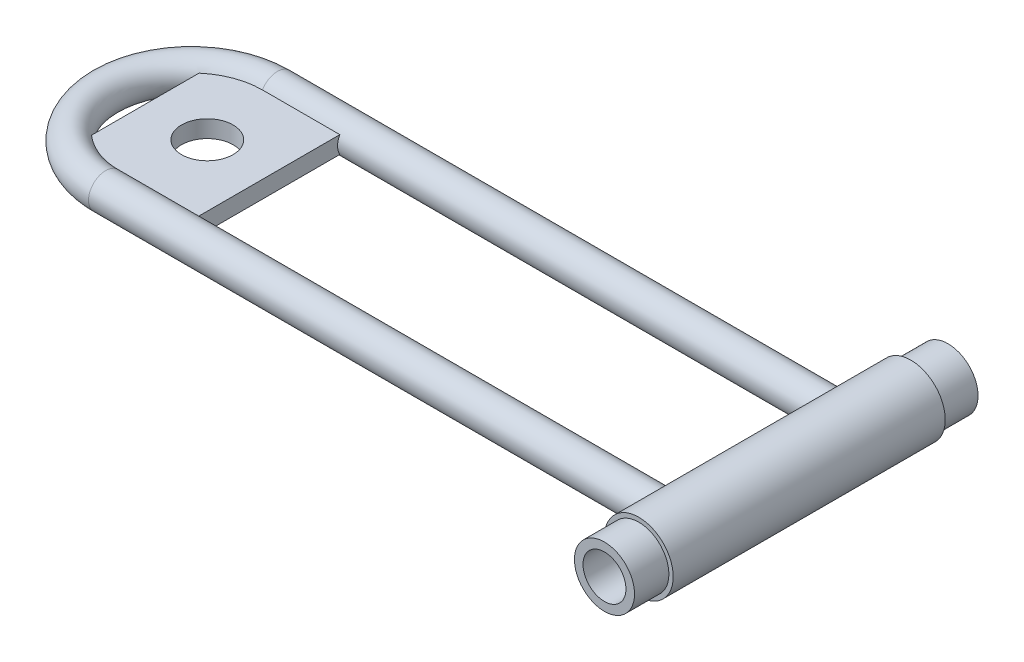
from build123d import *
from build123d.topology import SkipClean

# Parameters (mm, degrees)
SKETCH1_R           = 6.35
SKETCH1_R_2         = 3.175
BOSS_EXTRUDE1_DEPTH = 62.992
SKETCH3_R           = 3.175
SKETCH6_W           = 22.86
SKETCH6_H           = 1.5875
BOSS_EXTRUDE3_DEPTH = 29.21
SKETCH7_R           = 4.7625
CUT_EXTRUDE1_DEPTH  = 29.21
BOSS_EXTRUDE5_START = 6.35
SKETCH9_R           = 6.35
SKETCH9_R_2         = 3.175
BOSS_EXTRUDE5_DEPTH = 6.35
CUT_EXTRUDE6_START  = -12.7
SKETCH10_R          = 6.35
SKETCH10_R_2        = 5.55625
CUT_EXTRUDE6_DEPTH  = 12.7
SKETCH12_R          = 6.35
SKETCH12_R_2        = 5.55625
CUT_EXTRUDE7_DEPTH  = 12.7
CUT_EXTRUDE8_START  = -6.35
SKETCH13_R          = 5.55625
SKETCH13_R_2        = 3.175
CUT_EXTRUDE8_DEPTH  = 6.35
SKETCH14_R          = 5.55625
SKETCH14_R_2        = 3.175
CUT_EXTRUDE9_DEPTH  = 6.35
SKETCH16_R          = 3.96875
CUT_EXTRUDE11_DEPTH = 142.896915114
BOSS_EXTRUDE7_START = 0.508
SKETCH18_R          = 5.55625
SKETCH18_R_2        = 3.96875
BOSS_EXTRUDE7_DEPTH = 0.508


with BuildPart() as part:
    # Sketch1 → Boss-Extrude1 (new body)
    with BuildSketch(Plane.XY):
        Circle(SKETCH1_R)
        Circle(SKETCH1_R_2, mode=Mode.SUBTRACT)
    extrude(amount=BOSS_EXTRUDE1_DEPTH)

    # Sweep1: sweep along a path in Sketch4
    with BuildLine(Plane(origin=(0, 0, 0), x_dir=(1, 0, 0), z_dir=(0, 1, 0))) as sweep1_path:
        Line((-3.81, -15.663931971), (-107.95, -15.663931971))
        ThreePointArc((-107.95, -15.663931971), (-123.665226198, -31.37915817), (-107.95, -47.094384368))
        Line((-107.95, -47.094384368), (-3.81, -47.094384368))
    # Sketch3 → Sweep1 (sweep)
    with BuildSketch(Plane.ZY.offset(3.81)):
        with Locations((47.244, 0)):
            Circle(SKETCH3_R)
    sweep(path=sweep1_path.line)

    # Sketch6 → Boss-Extrude3 (add)
    with BuildSketch(Plane.XY.offset(15.24)):
        with Locations((-105.071320577, -0.79375)):
            Rectangle(SKETCH6_W, SKETCH6_H)
        with Locations((-105.071320577, 0.79375)):
            Rectangle(SKETCH6_W, SKETCH6_H)
    extrude(amount=BOSS_EXTRUDE3_DEPTH)

    # Sketch7 → Cut-Extrude1 (cut)
    with BuildSketch(Plane(origin=(0, 1.5875, 0), x_dir=(1, 0, 0), z_dir=(0, 1, 0))):
        with Locations(Location((-105.071320577, -31.341130791, 0), (0, 0, 180))):
            Circle(SKETCH7_R)
    extrude(amount=-CUT_EXTRUDE1_DEPTH, mode=Mode.SUBTRACT)

    # Sketch9 → Boss-Extrude5 (add)
    with BuildSketch(Plane(origin=(0, 0, 0), x_dir=(-1, 0, 0), z_dir=(0, 0, -1)).offset(BOSS_EXTRUDE5_START)):
        Circle(SKETCH9_R)
        Circle(SKETCH9_R_2, mode=Mode.SUBTRACT)
    boss_extrude5 = extrude(amount=-BOSS_EXTRUDE5_DEPTH)

    # Mirror1: Boss-Extrude5 across plane
    with SkipClean():  # the faces are left unmerged after this step: merging them gives an invalid solid
        add(boss_extrude5.mirror(Plane.XY.offset(31.496)))

    # Sketch10 → Cut-Extrude6 (cut)
    with BuildSketch(Plane.XY.offset(69.342).offset(CUT_EXTRUDE6_START)):
        with Locations(Location((0, 0, 0), (0, 0, 180))):
            Circle(SKETCH10_R)
        with Locations(Location((0, 0, 0), (0, 0, 180))):
            Circle(SKETCH10_R_2, mode=Mode.SUBTRACT)
    extrude(amount=CUT_EXTRUDE6_DEPTH, mode=Mode.SUBTRACT)

    # Sketch12 → Cut-Extrude7 (cut)
    with BuildSketch(Plane(origin=(0, 0, -6.35), x_dir=(-1, 0, 0), z_dir=(0, 0, -1))):
        Circle(SKETCH12_R)
        Circle(SKETCH12_R_2, mode=Mode.SUBTRACT)
    extrude(amount=-CUT_EXTRUDE7_DEPTH, mode=Mode.SUBTRACT)

    # Sketch13 → Cut-Extrude8 (cut)
    with BuildSketch(Plane.XY.offset(69.342).offset(CUT_EXTRUDE8_START)):
        with Locations(Location((0, 0, 0), (0, 0, 180))):
            Circle(SKETCH13_R)
        Circle(SKETCH13_R_2, mode=Mode.SUBTRACT)
    extrude(amount=CUT_EXTRUDE8_DEPTH, mode=Mode.SUBTRACT)

    # Sketch14 → Cut-Extrude9 (cut)
    with BuildSketch(Plane(origin=(0, 0, -6.35), x_dir=(-1, 0, 0), z_dir=(0, 0, -1))):
        Circle(SKETCH14_R)
        Circle(SKETCH14_R_2, mode=Mode.SUBTRACT)
    extrude(amount=-CUT_EXTRUDE9_DEPTH, mode=Mode.SUBTRACT)

    # Sketch16 → Cut-Extrude11 (cut, through all)
    with BuildSketch(Plane(origin=(0, 0, 0), x_dir=(-1, 0, 0), z_dir=(0, 0, -1))):
        Circle(SKETCH16_R)
    extrude(amount=-CUT_EXTRUDE11_DEPTH, mode=Mode.SUBTRACT)

    # Sketch18 → Boss-Extrude7 (add)
    with BuildSketch(Plane(origin=(0, 0, 0), x_dir=(-1, 0, 0), z_dir=(0, 0, -1)).offset(BOSS_EXTRUDE7_START)):
        Circle(SKETCH18_R)
        Circle(SKETCH18_R_2, mode=Mode.SUBTRACT)
    extrude(amount=-BOSS_EXTRUDE7_DEPTH)


solid = part.part
